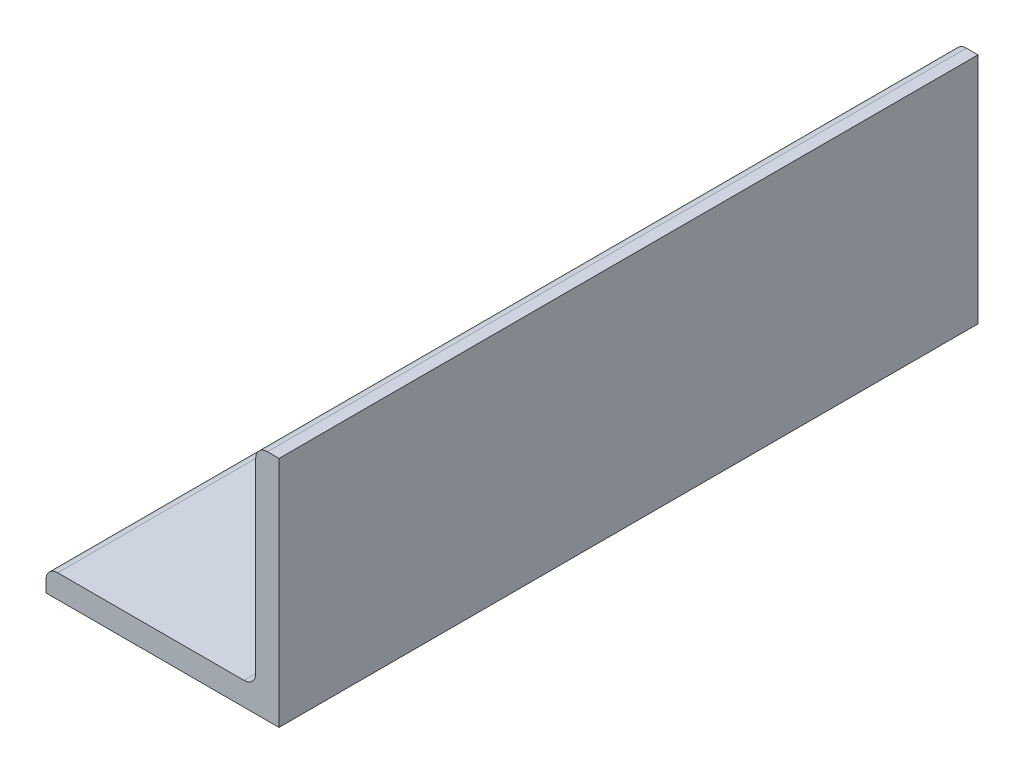
from build123d import *

# Parameters (mm, degrees)
BOSS_EXTRUDE1_DEPTH = 90


with BuildPart() as part:
    # Sketch1 → Boss-Extrude1 (new body)
    with BuildSketch(Plane.XY):
        with BuildLine():
            Line((-135.600940307, 27), (-135.600940307, -3))
            Line((-135.600940307, -3), (-165.600940307, -3))
            Line((-165.600940307, -3), (-165.600940307, -1.5))
            ThreePointArc((-165.600940307, -1.5), (-165.161600478, -0.439339828), (-164.100940307, 0))
            Line((-164.100940307, 0), (-140.100940307, 0))
            ThreePointArc((-140.100940307, 0), (-139.040280135, 0.439339828), (-138.600940307, 1.5))
            Line((-138.600940307, 1.5), (-138.600940307, 25.5))
            ThreePointArc((-138.600940307, 25.5), (-138.161600478, 26.560660172), (-137.100940307, 27))
            Line((-137.100940307, 27), (-135.600940307, 27))
        make_face()
    extrude(amount=BOSS_EXTRUDE1_DEPTH)


solid = part.part
